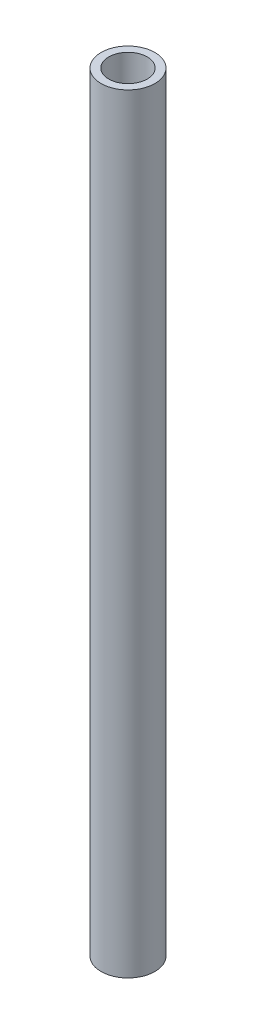
from build123d import *

# Parameters (mm, degrees)
SKETCH1_R           = 3.5
SKETCH1_R_2         = 2.5
BOSS_EXTRUDE1_DEPTH = 100


with BuildPart() as part:
    # Sketch1 → Boss-Extrude1 (new body)
    with BuildSketch(Plane(origin=(0, 0, 0), x_dir=(1, 0, 0), z_dir=(0, 1, 0))):
        with Locations(Location((0, 0, 0), (0, 0, 270))):
            Circle(SKETCH1_R)
        with Locations(Location((0, 0, 0), (0, 0, 270))):
            Circle(SKETCH1_R_2, mode=Mode.SUBTRACT)
    extrude(amount=BOSS_EXTRUDE1_DEPTH)


solid = part.part
